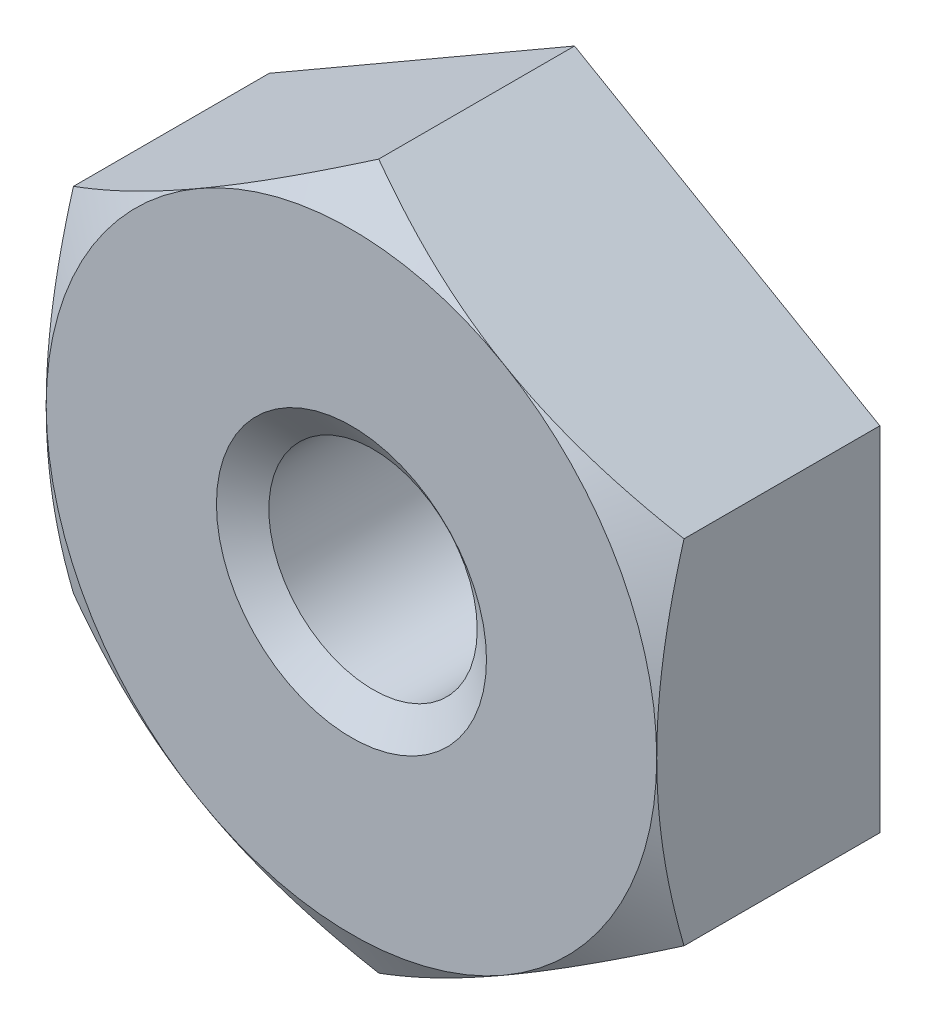
from build123d import *

# Parameters (mm, degrees)
BASENUT_START = -2.8956
BASENUTSKE_R  = 1.35255
BASENUT_DEPTH = 2.8956


with BuildPart() as part:
    # BaseNutSke → BaseNut (new body)
    with BuildSketch(Plane.XY.offset(BASENUT_START)):
        Polygon((3.9624, 2.287692707), (3.9624, -2.287692707), (0, -4.575385413), (-3.9624, -2.287692707), (-3.9624, 2.287692707), (0, 4.575385413), align=None)
        Circle(BASENUTSKE_R, mode=Mode.SUBTRACT)
    extrude(amount=BASENUT_DEPTH)

    # Sketch4 → Single-Chamfer (revolve, cut)
    with BuildSketch(Plane(origin=(0, 0, 0), x_dir=(0, 0, -1), z_dir=(1, 0, 0))):
        Polygon((0, 3.9624), (-12.7, 3.9624), (-12.7, 17.275385413), (0.353907293, 17.275385413), (0.353907293, 4.575385413), align=None)
    revolve(axis=Axis((0, 0, 0), (0, 0, -1)), mode=Mode.SUBTRACT)

    # EndChamferSketch → EndChamfer (revolve, cut)
    with BuildSketch(Plane(origin=(0, 0, 0), x_dir=(0, 0, -1), z_dir=(1, 0, 0)), mode=Mode.PRIVATE) as endchamfer_sk:
        Polygon((2.8702, 1.7526), (2.562070172, 1.312545), (2.921, 1.312545), (2.921, 1.7526), align=None)
        Polygon((-0.0508, 1.7526), (0, 1.7526), (0.308129828, 1.312545), (-0.0508, 1.312545), align=None)
    revolve(endchamfer_sk.sketch.rotate(Axis((0, 0, -25.037505729), (0, 0, -1)), 90), axis=Axis((0, 0, -25.037505729), (0, 0, -1)), mode=Mode.SUBTRACT)


solid = part.part
